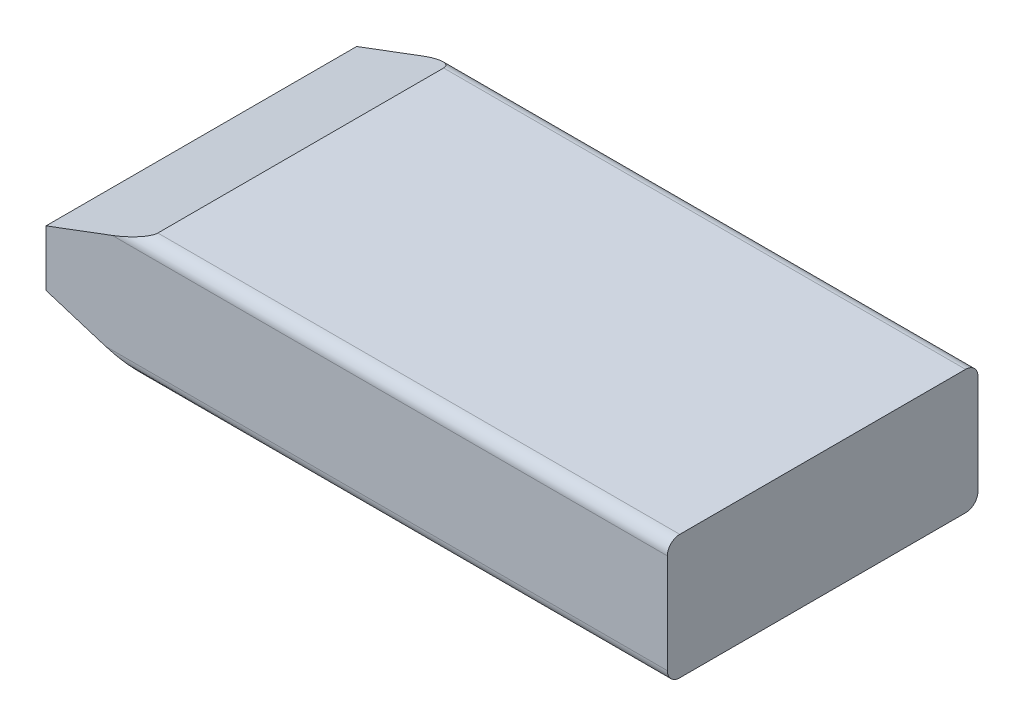
from build123d import *

# Parameters (mm, degrees)
SKETCH_1_W          = 50
SKETCH_1_H          = 25
EXTRUDE_1_DEPTH     = 10
FILLET_1_R          = 1
CUT_EXTRUDE_1_DEPTH = 28


with BuildPart() as part:
    # 草图1 → 凸台-拉伸1 (new body)
    with BuildSketch(Plane(origin=(0, 0, 0), x_dir=(1, 0, 0), z_dir=(0, 1, 0))):
        Rectangle(SKETCH_1_W, SKETCH_1_H)
    extrude(amount=EXTRUDE_1_DEPTH)

    # 圆角1
    fillet_1_edges = [part.edges().sort_by_distance(p)[0] for p in [
        (0, 10, 12.5),
        (0, 0, 12.5),
        (0, 0, -12.5),
        (0, 10, -12.5),
    ]]
    fillet(fillet_1_edges, radius=FILLET_1_R)

    # 草图2 → 切除-拉伸1 (cut)
    with BuildSketch(Plane.XY.offset(12.5)):
        Polygon((-25, 7), (-17, 10), (-17, 12), (-27, 12), (-27, -2), (-17, -2), (-17, 0), (-25, 2.5), align=None)
    extrude(amount=-CUT_EXTRUDE_1_DEPTH, mode=Mode.SUBTRACT)


solid = part.part
